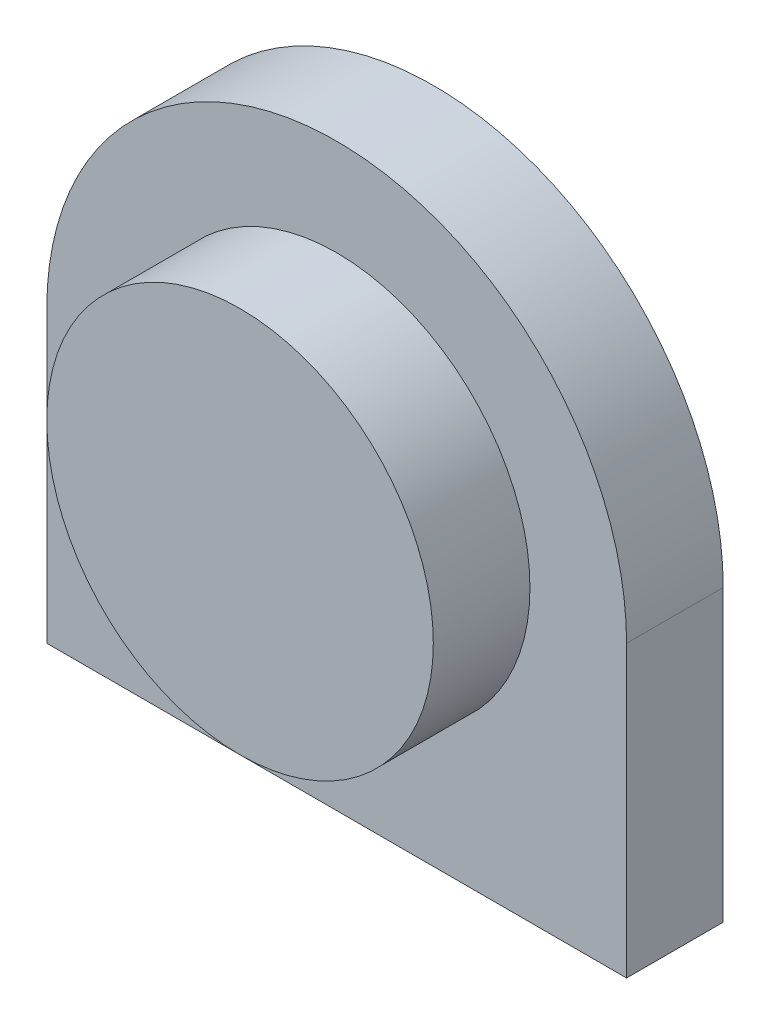
from build123d import *

# Parameters (mm, degrees)
EXTRUDE_1_DEPTH = 10
SKETCH_2_R      = 20
EXTRUDE_2_DEPTH = 10


with BuildPart() as part:
    # 草图1 → 凸台-拉伸1 (new body)
    with BuildSketch(Plane.XY):
        with BuildLine():
            Line((-30, 0), (-30, -30))
            Line((-30, -30), (30, -30))
            Line((30, -30), (30, 0))
            ThreePointArc((30, 0), (0, 30), (-30, 0))
        make_face()
    extrude(amount=EXTRUDE_1_DEPTH)

    # 草图2 → 凸台-拉伸2 (add)
    with BuildSketch(Plane.XY.offset(10)):
        Circle(SKETCH_2_R)
    extrude(amount=EXTRUDE_2_DEPTH)


solid = part.part
